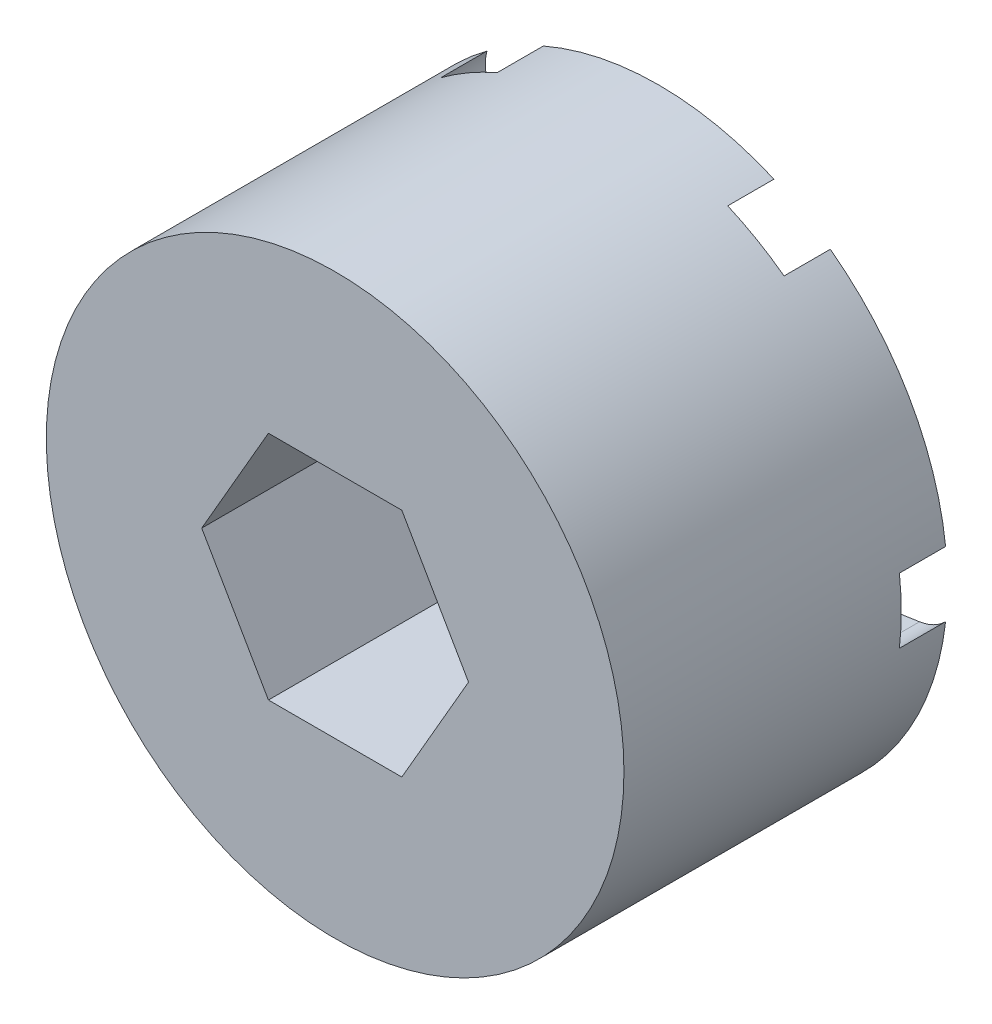
from build123d import *

# Parameters (mm, degrees)
BOSS_EXTRUDE1_DEPTH = 8.89
CUT_EXTRUDE1_DEPTH  = 10.16
CUT_EXTRUDE2_DEPTH  = 2.54


with BuildPart() as part:
    # Sketch1 → Boss-Extrude1 (new, symmetric)
    with BuildSketch(Plane.XY):
        with BuildLine():
            ThreePointArc((0, 15.875), (-15.875, 0), (0, -15.875))
            ThreePointArc((0, -15.875), (15.875, 0), (0, 15.875))
        make_face()
    extrude(amount=BOSS_EXTRUDE1_DEPTH, both=True)

    # Sketch2 → Cut-Extrude1 (cut)
    with BuildSketch(Plane.XY.offset(8.89)):
        Polygon((7.332348419, 0), (3.666174209, 6.35), (-3.666174209, 6.35), (-7.332348419, 0), (-3.666174209, -6.35), (3.666174209, -6.35), align=None)
    extrude(amount=-CUT_EXTRUDE1_DEPTH, mode=Mode.SUBTRACT)

    # Sketch4 → Cut-Extrude2 (cut)
    with BuildSketch(Plane(origin=(0, 0, -8.89), x_dir=(-1, 0, 0), z_dir=(0, 0, -1))):
        with BuildLine():
            Line((-6.379143124, 3.683), (-9.346003624, 11.161752295))
            ThreePointArc((-9.346003624, 11.161752295), (-8.255, 14.298079416), (-4.993359226, 13.674752709))
            Line((-4.993359226, 13.674752709), (0, 7.366))
            Line((0, 7.366), (4.993359226, 13.674752709))
            ThreePointArc((4.993359226, 13.674752709), (8.255, 14.298079416), (9.346003624, 11.161752295))
            Line((9.346003624, 11.161752295), (6.379143124, 3.683))
            Line((6.379143124, 3.683), (14.33936285, 2.513000415))
            ThreePointArc((14.33936285, 2.513000415), (16.51, 0), (14.33936285, -2.513000415))
            Line((14.33936285, -2.513000415), (6.379143124, -3.683))
            Line((6.379143124, -3.683), (9.346003624, -11.161752295))
            ThreePointArc((9.346003624, -11.161752295), (8.255, -14.298079416), (4.993359226, -13.674752709))
            Line((4.993359226, -13.674752709), (0, -7.366))
            Line((0, -7.366), (-4.993359226, -13.674752709))
            ThreePointArc((-4.993359226, -13.674752709), (-8.255, -14.298079416), (-9.346003624, -11.161752295))
            Line((-9.346003624, -11.161752295), (-6.379143124, -3.683))
            Line((-6.379143124, -3.683), (-14.33936285, -2.513000415))
            ThreePointArc((-14.33936285, -2.513000415), (-16.51, 0), (-14.33936285, 2.513000415))
            Line((-14.33936285, 2.513000415), (-6.379143124, 3.683))
        make_face()
    extrude(amount=-CUT_EXTRUDE2_DEPTH, mode=Mode.SUBTRACT)


solid = part.part
